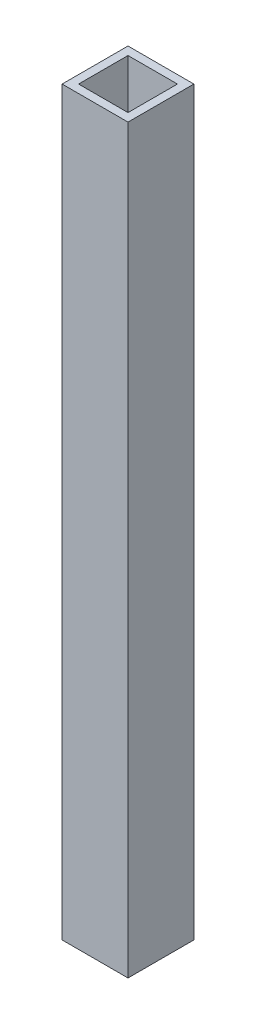
from build123d import *

# Parameters (mm, degrees)
SCHIZZO1_W                   = 40
SCHIZZO1_H                   = 40
SCHIZZO1_W_2                 = 30
SCHIZZO1_H_2                 = 30
ESTRUSIONE_ESTRUSIONE1_DEPTH = 450


with BuildPart() as part:
    # Schizzo1 → Estrusione-Estrusione1 (new body)
    with BuildSketch(Plane(origin=(0, 0, 0), x_dir=(1, 0, 0), z_dir=(0, 1, 0))):
        Rectangle(SCHIZZO1_W, SCHIZZO1_H)
        Rectangle(SCHIZZO1_W_2, SCHIZZO1_H_2, mode=Mode.SUBTRACT)
    extrude(amount=ESTRUSIONE_ESTRUSIONE1_DEPTH)


solid = part.part
